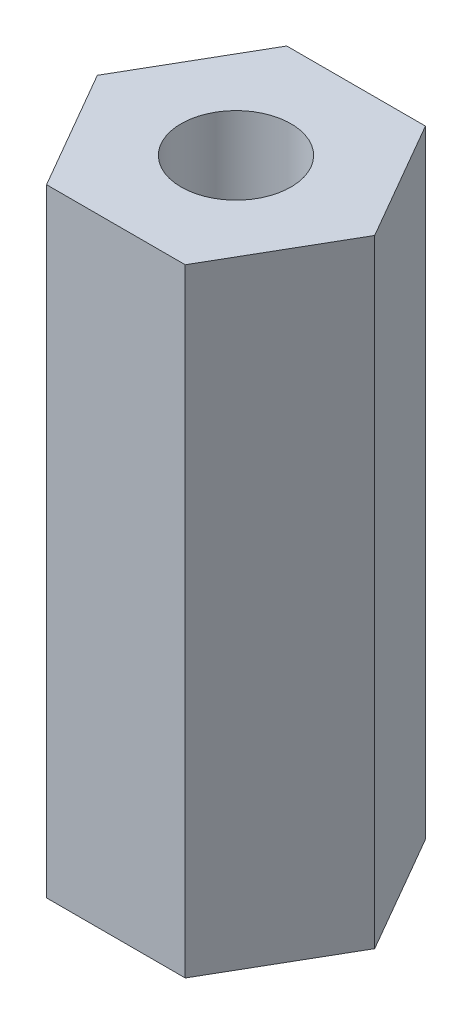
from build123d import *

# Parameters (mm, degrees)
SKETCH_1_R      = 1.6
EXTRUDE_2_DEPTH = 18


with BuildPart() as part:
    # 草图1 → 凸台-拉伸2 (new body)
    with BuildSketch(Plane(origin=(0, 0, 0), x_dir=(1, 0, 0), z_dir=(0, 1, 0))):
        Polygon((4.041451884, 0), (2.020725942, 3.5), (-2.020725942, 3.5), (-4.041451884, 0), (-2.020725942, -3.5), (2.020725942, -3.5), align=None)
        with Locations(Location((0, 0, 0), (0, 0, 270))):
            Circle(SKETCH_1_R, mode=Mode.SUBTRACT)
    extrude(amount=EXTRUDE_2_DEPTH)


solid = part.part
